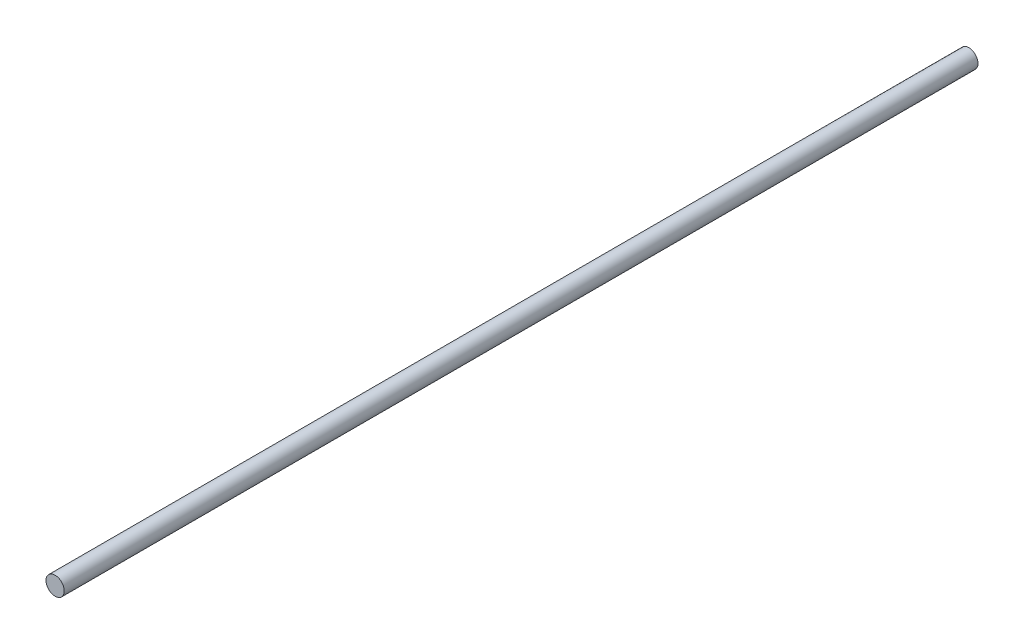
from build123d import *

# Parameters (mm, degrees)
SKETCH_1_R      = 1
EXTRUDE_1_DEPTH = 50


with BuildPart() as part:
    # 草图1 → 凸台-拉伸1 (new, symmetric)
    with BuildSketch(Plane.XY):
        Circle(SKETCH_1_R)
    extrude(amount=EXTRUDE_1_DEPTH, both=True)


solid = part.part
